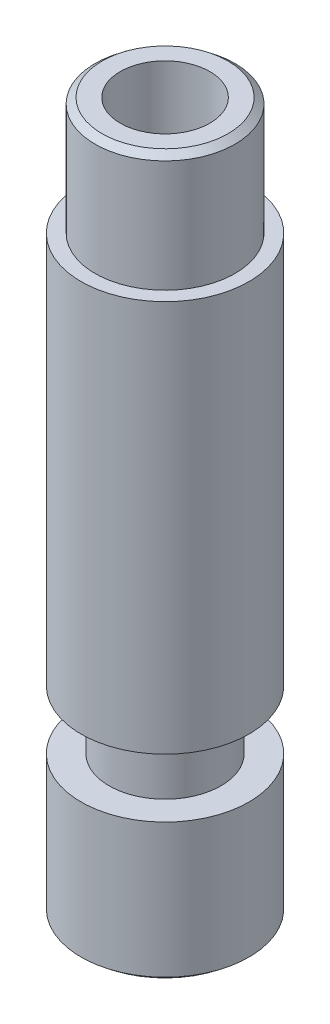
from build123d import *

# Parameters (mm, degrees)
SKETCH3_R          = 1.6
CUT_EXTRUDE1_DEPTH = 26.653264899


with BuildPart() as part:
    # Sketch1 → Revolve1 (revolve)
    with BuildSketch(Plane.XY, mode=Mode.PRIVATE) as revolve1_sk:
        Polygon((3, 0.2), (2.75, 0), (0, 0), (0, 25.3), (2.25, 25.3), (2.5, 25.1), (2.5, 21.1), (3, 21.1), (3, 7.1), (2, 7.1), (2, 5), (3, 5), align=None)
    revolve(revolve1_sk.sketch.rotate(Axis((0, 0, 0), (0, 1, 0)), 90), axis=Axis((0, 0, 0), (0, 1, 0)))

    # Sketch3 → Cut-Extrude1 (cut, through all)
    with BuildSketch(Plane(origin=(0, 25.3, 0), x_dir=(1, 0, 0), z_dir=(0, 1, 0))):
        with Locations(Location((0, 0, 0), (0, 0, 270))):
            Circle(SKETCH3_R)
    extrude(amount=-CUT_EXTRUDE1_DEPTH, mode=Mode.SUBTRACT)


solid = part.part
